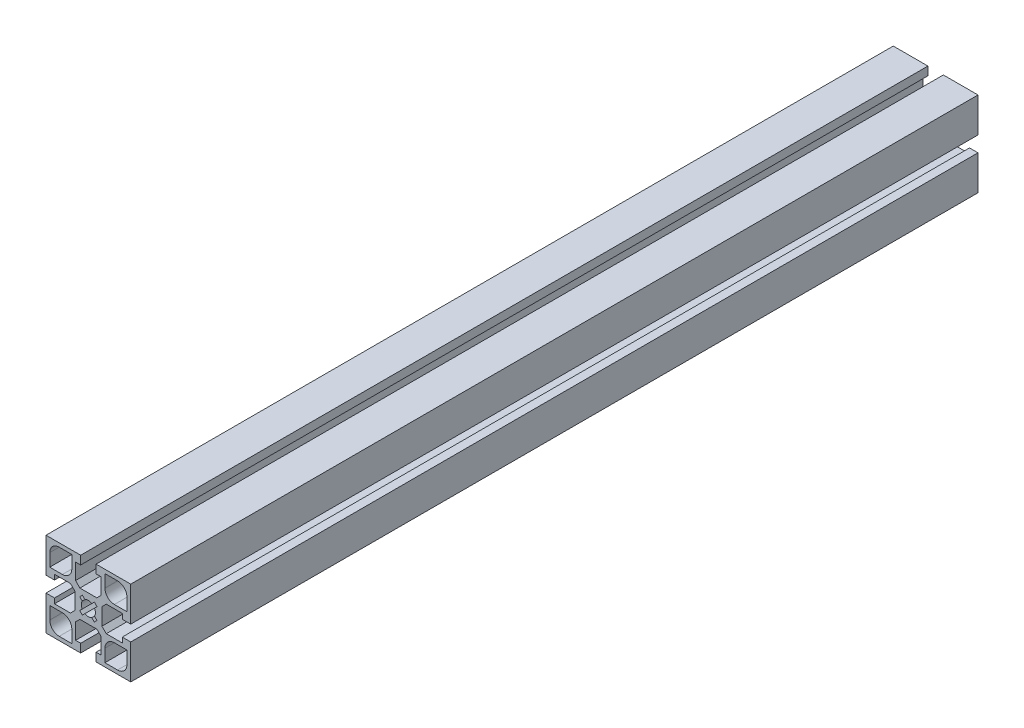
from build123d import *

# Parameters (mm, degrees)
BOSS_EXTRUDE1_DEPTH = 300
SCALE1_SCALE_X      = 0.6667
SCALE1_SCALE_Y      = 0.6667
SCALE1_SCALE_Z      = 1


with BuildPart() as part:
    # Sketch1 → Boss-Extrude1 (new body)
    with BuildSketch(Plane.XY):
        Polygon((-17.999999991, -6.799999991), (-17.999999991, -4.099999991), (-22.499999991, -4.099999991), (-22.499999991, -22.499999991), (-4.099999991, -22.499999991), (-4.099999991, -17.999999991), (-6.799999991, -17.999999991), (-6.799999991, -9.499999991), (-4.499999991, -7.199999991), (4.500000009, -7.199999991), (6.800000009, -9.499999991), (6.800000009, -17.999999991), (4.100000009, -17.999999991), (4.100000009, -22.499999991), (22.500000009, -22.499999991), (22.500000009, -4.099999991), (18.000000009, -4.099999991), (18.000000009, -6.799999991), (9.500000009, -6.799999991), (7.200000009, -4.499999991), (7.200000009, 4.500000009), (9.500000009, 6.800000009), (18.000000009, 6.800000009), (18.000000009, 4.100000009), (22.500000009, 4.100000009), (22.500000009, 22.500000009), (4.100000009, 22.500000009), (4.100000009, 18.000000009), (6.800000009, 18.000000009), (6.800000009, 9.500000009), (4.500000009, 7.200000009), (-4.499999991, 7.200000009), (-6.799999991, 9.500000009), (-6.799999991, 18.000000009), (-4.099999991, 18.000000009), (-4.099999991, 22.500000009), (-22.499999991, 22.500000009), (-22.499999991, 4.100000009), (-17.999999991, 4.100000009), (-17.999999991, 6.800000009), (-9.499999991, 6.800000009), (-7.199999991, 4.500000009), (-7.199999991, -4.499999991), (-9.499999991, -6.799999991), align=None)
        with BuildLine():
            Line((-20.499999973, 8.799995438), (-20.499999973, 15.500000009))
            ThreePointArc((-20.499999973, 15.500000009), (-19.035533879, 19.035533915), (-15.499999973, 20.500000009))
            Line((-15.499999973, 20.500000009), (-8.799995402, 20.500000009))
            Line((-8.799995402, 20.500000009), (-8.799995402, 13.799995438))
            ThreePointArc((-8.799995402, 13.799995438), (-10.264461496, 10.264461532), (-13.799995402, 8.799995438))
            Line((-13.799995402, 8.799995438), (-20.499999973, 8.799995438))
        make_face(mode=Mode.SUBTRACT)
        with BuildLine():
            Line((20.500000009, 8.79999542), (13.799995438, 8.79999542))
            ThreePointArc((13.799995438, 8.79999542), (10.264461532, 10.264461514), (8.799995438, 13.79999542))
            Line((8.799995438, 13.79999542), (8.799995438, 20.499999991))
            Line((8.799995438, 20.499999991), (15.500000009, 20.499999991))
            ThreePointArc((15.500000009, 20.499999991), (19.035533915, 19.035533897), (20.500000009, 15.499999991))
            Line((20.500000009, 15.499999991), (20.500000009, 8.79999542))
        make_face(mode=Mode.SUBTRACT)
        with BuildLine():
            Line((15.499999991, -20.499999991), (8.79999542, -20.499999991))
            Line((8.79999542, -20.499999991), (8.79999542, -13.79999542))
            ThreePointArc((8.79999542, -13.79999542), (10.264461514, -10.264461514), (13.79999542, -8.79999542))
            Line((13.79999542, -8.79999542), (20.499999991, -8.79999542))
            Line((20.499999991, -8.79999542), (20.499999991, -15.499999991))
            ThreePointArc((20.499999991, -15.499999991), (19.035533897, -19.035533897), (15.499999991, -20.499999991))
        make_face(mode=Mode.SUBTRACT)
        with BuildLine():
            Line((-8.79999542, -20.499999973), (-15.499999991, -20.499999973))
            ThreePointArc((-15.499999991, -20.499999973), (-19.035533897, -19.035533879), (-20.499999991, -15.499999973))
            Line((-20.499999991, -15.499999973), (-20.499999991, -8.799995402))
            Line((-20.499999991, -8.799995402), (-13.79999542, -8.799995402))
            ThreePointArc((-13.79999542, -8.799995402), (-10.264461514, -10.264461496), (-8.79999542, -13.799995402))
            Line((-8.79999542, -13.799995402), (-8.79999542, -20.499999973))
        make_face(mode=Mode.SUBTRACT)
        with BuildLine():
            Line((-3.262737816, 1.848524254), (-4.596194076, 3.181980514))
            Line((-4.596194076, 3.181980514), (-3.181980513, 4.596194076))
            Line((-3.181980513, 4.596194076), (-1.848524253, 3.262737816))
            ThreePointArc((-1.848524253, 3.262737816), (2e-09, 3.749999997), (1.848524257, 3.262737816))
            Line((1.848524257, 3.262737816), (3.181980517, 4.596194076))
            Line((3.181980517, 4.596194076), (4.59619408, 3.181980513))
            Line((4.59619408, 3.181980513), (3.26273782, 1.848524253))
            ThreePointArc((3.26273782, 1.848524253), (3.75, -2e-09), (3.262737819, -1.848524257))
            Line((3.262737819, -1.848524257), (4.596194079, -3.181980517))
            Line((4.596194079, -3.181980517), (3.181980517, -4.596194079))
            Line((3.181980517, -4.596194079), (1.848524257, -3.262737819))
            ThreePointArc((1.848524257, -3.262737819), (2e-09, -3.75), (-1.848524253, -3.262737819))
            Line((-1.848524253, -3.262737819), (-3.181980515, -4.596194081))
            Line((-3.181980515, -4.596194081), (-4.596194078, -3.181980518))
            Line((-4.596194078, -3.181980518), (-3.262737816, -1.848524257))
            ThreePointArc((-3.262737816, -1.848524257), (-3.749999997, -2e-09), (-3.262737816, 1.848524254))
        make_face(mode=Mode.SUBTRACT)
    extrude(amount=BOSS_EXTRUDE1_DEPTH)


with BuildPart() as part_1:
    # Scale1: scaled about (1e-08, 1e-08, 150)
    add(part.part.scale((SCALE1_SCALE_X, SCALE1_SCALE_Y, SCALE1_SCALE_Z), about=(1e-08, 1e-08, 150)))


solid = part_1.part
